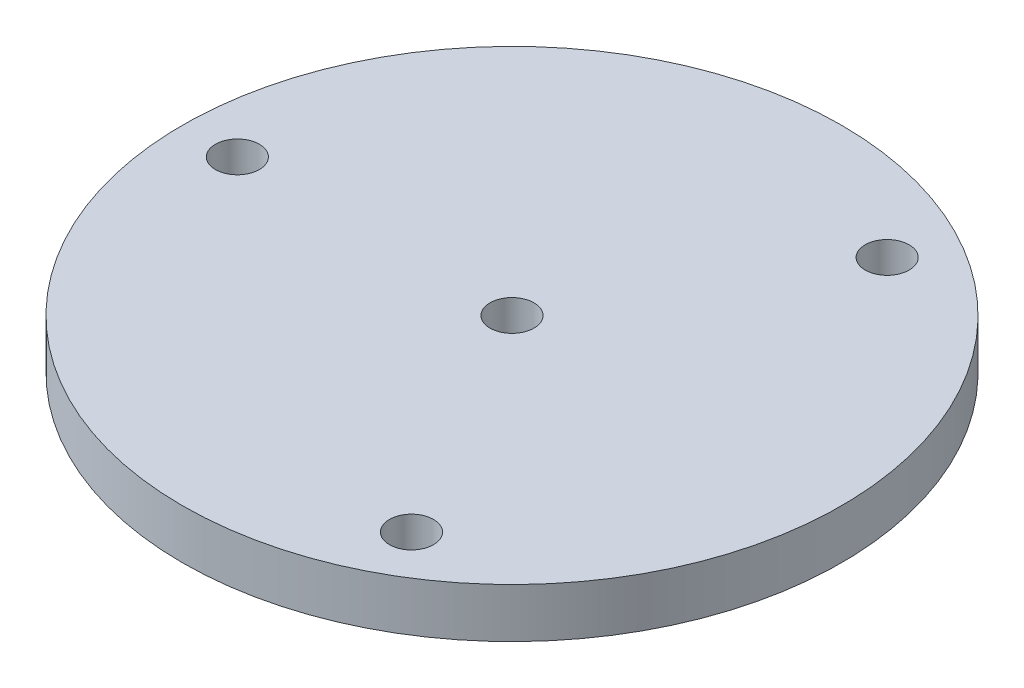
from build123d import *

# Parameters (mm, degrees)
SKETCH1_R           = 60
SKETCH1_R_2         = 4
BOSS_EXTRUDE1_DEPTH = 9


with BuildPart() as part:
    # Sketch1 → Boss-Extrude1 (new body)
    with BuildSketch(Plane(origin=(0, 0, 0), x_dir=(1, 0, 0), z_dir=(0, 1, 0))):
        with Locations(Location((0, 0, 0), (0, 0, 270))):
            Circle(SKETCH1_R)
        with Locations(Location((0, 0, 0), (0, 0, 270))):
            Circle(SKETCH1_R_2, mode=Mode.SUBTRACT)
        with Locations(Location((-50, 0, 0), (0, 0, 270))):
            Circle(SKETCH1_R_2, mode=Mode.SUBTRACT)
        with Locations(Location((25, 43.301270189, 0), (0, 0, 270))):
            Circle(SKETCH1_R_2, mode=Mode.SUBTRACT)
        with Locations(Location((25, -43.301270189, 0), (0, 0, 270))):
            Circle(SKETCH1_R_2, mode=Mode.SUBTRACT)
    extrude(amount=BOSS_EXTRUDE1_DEPTH)


solid = part.part
